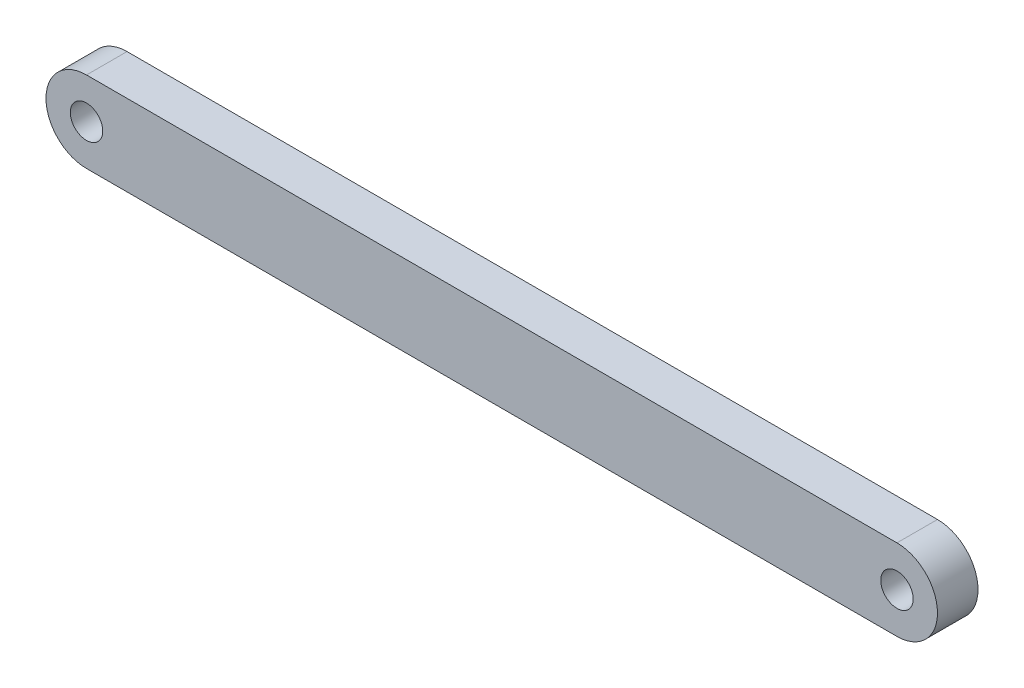
from build123d import *

# Parameters (mm, degrees)
CROQUIS1_R              = 2
SALIENTE_EXTRUIR1_DEPTH = 5


with BuildPart() as part:
    # Croquis1 → Saliente-Extruir1 (new body)
    with BuildSketch(Plane.XY):
        with BuildLine():
            Line((0, 5), (100, 5))
            ThreePointArc((100, 5), (105, 0), (100, -5))
            Line((100, -5), (0, -5))
            ThreePointArc((0, -5), (-5, 0), (0, 5))
        make_face()
        Circle(CROQUIS1_R, mode=Mode.SUBTRACT)
        with Locations((100, 0)):
            Circle(CROQUIS1_R, mode=Mode.SUBTRACT)
    extrude(amount=SALIENTE_EXTRUIR1_DEPTH)


solid = part.part
